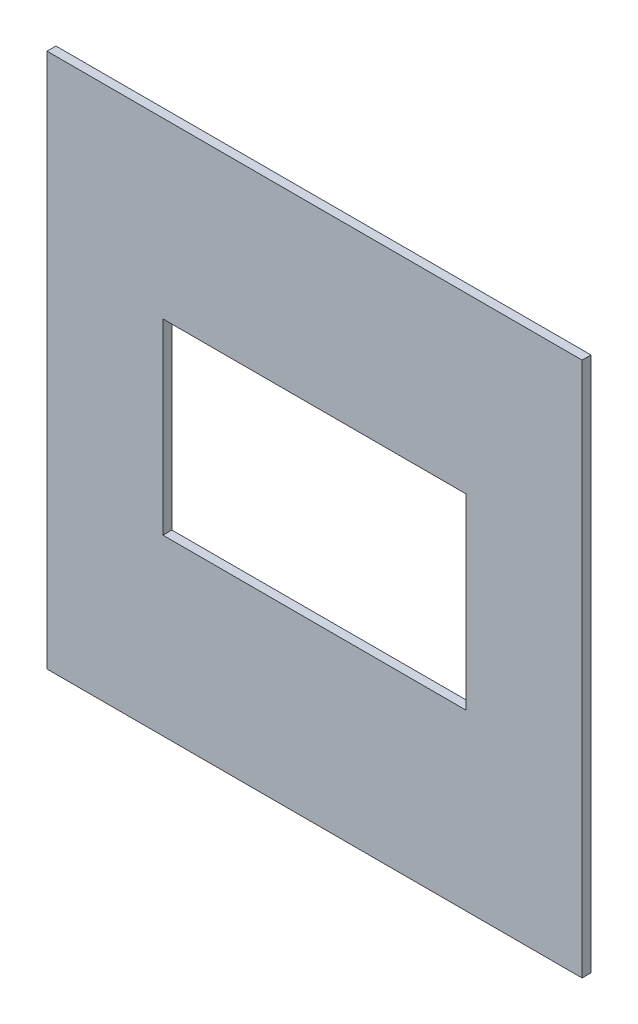
from build123d import *

# Parameters (mm, degrees)
ESQUISSE1_W             = 300
ESQUISSE1_H             = 300
BOSS_EXTRU_2_DEPTH      = 5
ESQUISSE2_W             = 170
ESQUISSE2_H             = 105
ENL_V_MAT_EXTRU_1_DEPTH = 5


with BuildPart() as part:
    # Esquisse1 → Boss.-Extru.2 (new body)
    with BuildSketch(Plane.XY):
        with Locations((150, 150)):
            Rectangle(ESQUISSE1_W, ESQUISSE1_H)
    extrude(amount=BOSS_EXTRU_2_DEPTH)

    # Esquisse2 → Enlèv. mat.-Extru.1 (cut)
    with BuildSketch(Plane.XY.offset(5)):
        with Locations((150, 150)):
            Rectangle(ESQUISSE2_W, ESQUISSE2_H)
    extrude(amount=-ENL_V_MAT_EXTRU_1_DEPTH, mode=Mode.SUBTRACT)


solid = part.part
